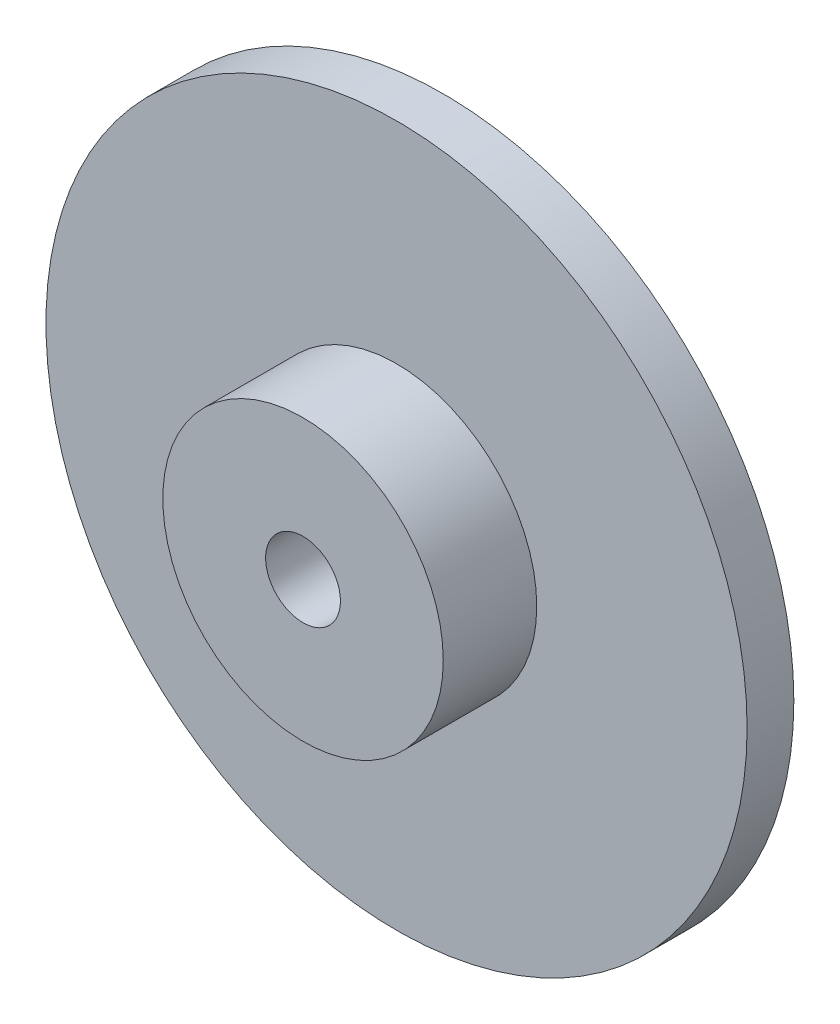
from build123d import *

# Parameters (mm, degrees)
SKETCH1_R           = 75
BOSS_EXTRUDE1_DEPTH = 10
SKETCH2_R           = 30
BOSS_EXTRUDE2_DEPTH = 20
SKETCH3_R           = 8
CUT_EXTRUDE1_DEPTH  = 111.227038425
CUT_EXTRUDE2_START  = -5
SKETCH4_W           = 5
SKETCH4_H           = 6
CUT_EXTRUDE2_DEPTH  = 20


with BuildPart() as part:
    # Sketch1 → Boss-Extrude1 (new body)
    with BuildSketch(Plane.XY):
        Circle(SKETCH1_R)
    extrude(amount=BOSS_EXTRUDE1_DEPTH)

    # Sketch2 → Boss-Extrude2 (add)
    with BuildSketch(Plane.XY.offset(10)):
        Circle(SKETCH2_R)
    extrude(amount=BOSS_EXTRUDE2_DEPTH)

    # Sketch3 → Cut-Extrude1 (cut, through all)
    with BuildSketch(Plane.XY.offset(30)):
        Circle(SKETCH3_R)
    extrude(amount=-CUT_EXTRUDE1_DEPTH, mode=Mode.SUBTRACT)

    # Sketch4 → Cut-Extrude2 (cut)
    with BuildSketch(Plane.XY.offset(30).offset(CUT_EXTRUDE2_START)):
        with Locations((0, 8)):
            Rectangle(SKETCH4_W, SKETCH4_H)
    extrude(amount=-CUT_EXTRUDE2_DEPTH, mode=Mode.SUBTRACT)


solid = part.part
